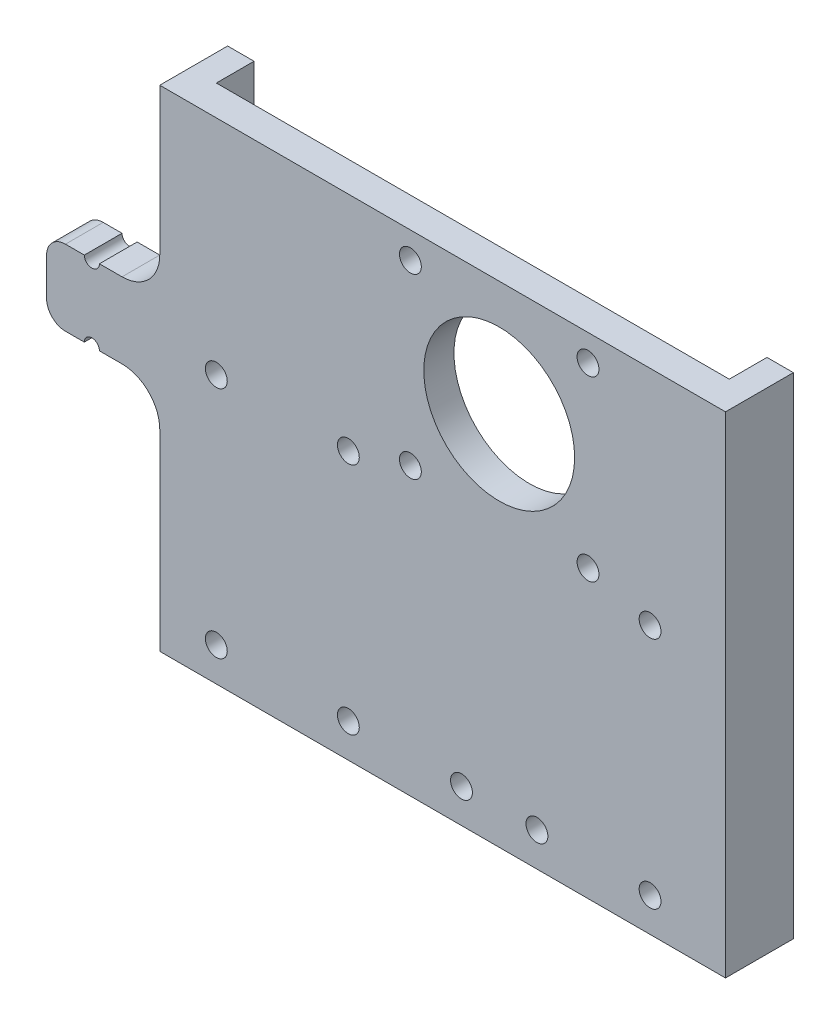
from build123d import *

# Parameters (mm, degrees)
SKETCH1_W            = 100
SKETCH1_H            = 130
BOSS_EXTRUDE1_DEPTH  = 8
M5_CLEARANCE_HOLE1_D = 5.8
SKETCH6_R            = 20
CUT_EXTRUDE1_DEPTH   = 10
SKETCH9_W            = 40
SKETCH9_H            = 130
SKETCH9_W_2          = 10
BOSS_EXTRUDE2_DEPTH  = 8
M5_CLEARANCE_HOLE2_D = 5.8
SKETCH13_W           = 7
SKETCH13_H           = 130
BOSS_EXTRUDE3_DEPTH  = 10
SKETCH14_W           = 30
SKETCH14_H           = 20
BOSS_EXTRUDE4_DEPTH  = 10
FILLET1_R            = 10
FILLET2_R            = 5
CUT_EXTRUDE2_REACH   = 138.839


with BuildPart() as part:
    # Sketch1 → Boss-Extrude1 (new body)
    with BuildSketch(Plane.XY):
        Rectangle(SKETCH1_W, SKETCH1_H)
    extrude(amount=BOSS_EXTRUDE1_DEPTH)

    # M5 Clearance Hole1 (through all)
    with Locations(Plane.XY.offset(8)):
        with Locations((-40, 6), (40, 6), (-40, -56), (40, -56), (-23.55, 58), (23.55, 58), (-23.55, 10.9), (23.55, 10.9), (-10, -56), (10, -56)):
            Hole(M5_CLEARANCE_HOLE1_D / 2)

    # Sketch6 → Cut-Extrude1 (cut)
    with BuildSketch(Plane.XY.offset(8)):
        with Locations((0, 34.5)):
            Circle(SKETCH6_R)
    extrude(amount=-CUT_EXTRUDE1_DEPTH, mode=Mode.SUBTRACT)

    # Sketch9 → Boss-Extrude2 (add)
    with BuildSketch(Plane.XY.offset(8)):
        with Locations((-70, 0)):
            Rectangle(SKETCH9_W, SKETCH9_H)
        with Locations((55, 0)):
            Rectangle(SKETCH9_W_2, SKETCH9_H)
    extrude(amount=-BOSS_EXTRUDE2_DEPTH)

    # M5 Clearance Hole2 (through all)
    with Locations(Plane.XY.offset(8)):
        with Locations((-75, 6), (-75, -56)):
            Hole(M5_CLEARANCE_HOLE2_D / 2)

    # Sketch13 → Boss-Extrude3 (add)
    with BuildSketch(Plane(origin=(0, 0, 0), x_dir=(-1, 0, 0), z_dir=(0, 0, -1))):
        with Locations((-56.5, 0)):
            Rectangle(SKETCH13_W, SKETCH13_H)
        with Locations((86.5, 0)):
            Rectangle(SKETCH13_W, SKETCH13_H)
    extrude(amount=BOSS_EXTRUDE3_DEPTH)

    # Sketch14 → Boss-Extrude4 (add)
    with BuildSketch(Plane.XY.offset(8)):
        with Locations((-105, 6)):
            Rectangle(SKETCH14_W, SKETCH14_H)
    extrude(amount=-BOSS_EXTRUDE4_DEPTH)

    # Fillet1
    fillet1_edges = [part.edges().sort_by_distance(p)[0] for p in [
        (-90, 16, 3),
        (-90, -4, 3),
    ]]
    fillet(fillet1_edges, radius=FILLET1_R)

    # Fillet2
    fillet2_edges = [part.edges().sort_by_distance(p)[0] for p in [
        (-120, -4, 3),
        (-120, 16, 3),
    ]]
    fillet(fillet2_edges, radius=FILLET2_R)

    # Sketch15 → Cut-Extrude2 (cut, up to next)
    with BuildSketch(Plane(origin=(0, 0, -2), x_dir=(-1, 0, 0), z_dir=(0, 0, -1)), mode=Mode.PRIVATE) as cut_extrude2_sk1:
        with BuildLine():
            Line((106, 16), (110, 16))
            ThreePointArc((110, 16), (108, 14), (106, 16))
        make_face()
    cut_extrude2_tool1 = extrude(cut_extrude2_sk1.sketch, amount=-CUT_EXTRUDE2_REACH, mode=Mode.PRIVATE) & part.part
    # Sketch15 → Cut-Extrude2 (cut, up to next)
    with BuildSketch(Plane(origin=(0, 0, -2), x_dir=(-1, 0, 0), z_dir=(0, 0, -1)), mode=Mode.PRIVATE) as cut_extrude2_sk2:
        with BuildLine():
            Line((110, -4), (106, -4))
            ThreePointArc((106, -4), (108, -2), (110, -4))
        make_face()
    cut_extrude2_tool2 = extrude(cut_extrude2_sk2.sketch, amount=-CUT_EXTRUDE2_REACH, mode=Mode.PRIVATE) & part.part
    add(cut_extrude2_tool1.solids().sort_by_distance((-108, 15.151174, -2))[0], mode=Mode.SUBTRACT)
    add(cut_extrude2_tool2.solids().sort_by_distance((-108, -3.151174, -2))[0], mode=Mode.SUBTRACT)


solid = part.part
